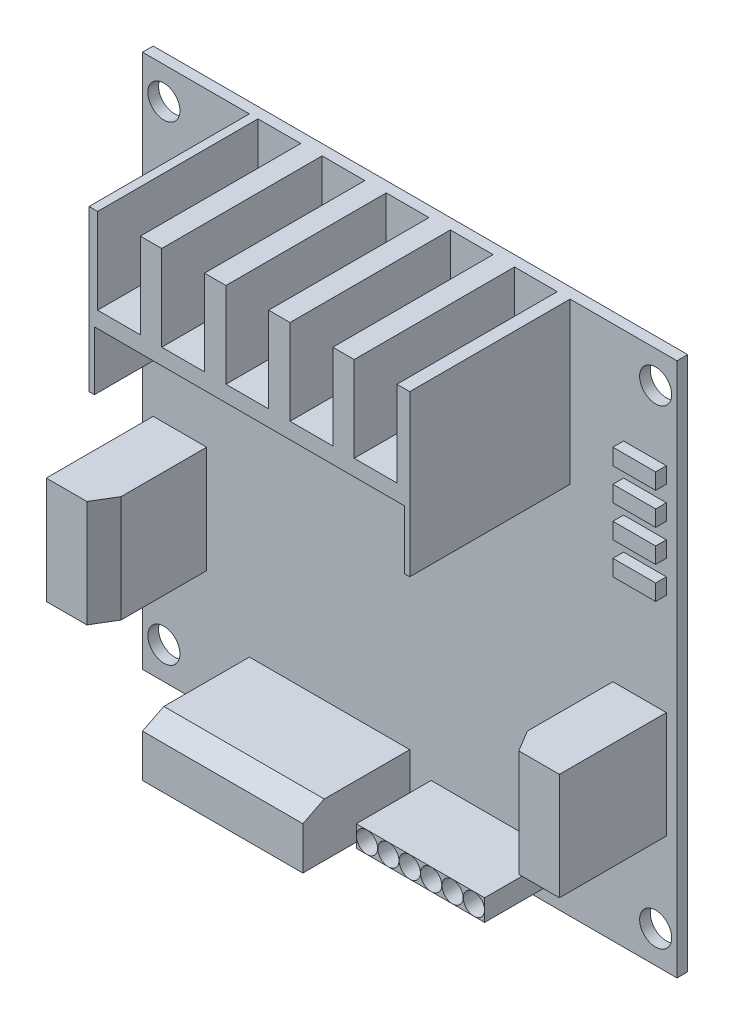
from build123d import *

# Parameters (mm, degrees)
SKETCH1_W               = 50
SKETCH1_H               = 50
BOSS_EXTRUDE1_DEPTH     = 1
SKETCH2_W               = 30
SKETCH2_H               = 15
BOSS_EXTRUDE2_DEPTH     = 15
SKETCH3_W               = 4
SKETCH3_H               = 8
CUT_EXTRUDE1_DEPTH      = 15
LPATTERN1_COUNT         = 5
LPATTERN1_PITCH         = 6
SKETCH4_W               = 28.997930891
SKETCH4_H               = 2
SKETCH4_H_2             = 2.5
SKETCH4_H_3             = 1
CUT_EXTRUDE2_DEPTH      = 2
CUT_EXTRUDE3_START      = -7
SKETCH4_3_W             = 28.997930891
SKETCH4_3_H             = 2
SKETCH4_3_H_2           = 2.5
CUT_EXTRUDE3_DEPTH      = 5
CUT_EXTRUDE4_START      = -15
SKETCH4_4_W             = 28.997930891
SKETCH4_4_H             = 2
CUT_EXTRUDE4_DEPTH      = 8
CUT_EXTRUDE5_DEPTH      = 1
SKETCH6_R               = 1.5
SKETCH6_W               = 2.5
SKETCH6_H               = 0.3
SKETCH6_W_2             = 0.3
SKETCH6_H_2             = 2.5
SKETCH6_H_3             = 1.1
SKETCH6_W_3             = 1.1
BOSS_EXTRUDE3_DEPTH     = 0.1
SKETCH6_3_R             = 1.5
BOSS_EXTRUDE4_DEPTH     = 1
SKETCH7_R               = 1.5
CUT_EXTRUDE6_DEPTH      = 73.284161474
SKETCH8_W               = 4
SKETCH8_H               = 1.5
BOSS_EXTRUDE5_DEPTH     = 1
LPATTERN2_COUNT         = 4
LPATTERN2_PITCH         = 3
MIRROR1_COPY_1_SKETCH_W = 4
MIRROR1_COPY_1_SKETCH_H = 1.5
MIRROR1_COPY_1_DEPTH    = 1
MIRROR1_COPY_2_SKETCH_W = 4
MIRROR1_COPY_2_SKETCH_H = 1.5
MIRROR1_COPY_2_DEPTH    = 1
MIRROR1_COPY_3_SKETCH_W = 4
MIRROR1_COPY_3_SKETCH_H = 1.5
MIRROR1_COPY_3_DEPTH    = 1
SKETCH9_W               = 5
SKETCH9_H               = 10
BOSS_EXTRUDE6_DEPTH     = 10
CUT_EXTRUDE7_DEPTH      = 10
SKETCH11_W              = 15
SKETCH11_H              = 5
BOSS_EXTRUDE7_DEPTH     = 10
CUT_EXTRUDE8_REACH      = 60.146
SKETCH13_W              = 2
SKETCH13_H              = 2
SKETCH13_R              = 0.995
BOSS_EXTRUDE9_DEPTH     = 7
LPATTERN3_COUNT         = 6
LPATTERN3_PITCH         = 2


with BuildPart() as part:
    # Sketch1 → Boss-Extrude1 (new body)
    with BuildSketch(Plane.XY):
        with Locations((25, 25)):
            Rectangle(SKETCH1_W, SKETCH1_H)
    extrude(amount=BOSS_EXTRUDE1_DEPTH)

    # Sketch2 → Boss-Extrude2 (add)
    with BuildSketch(Plane.XY.offset(1)):
        with Locations((25, 42.5)):
            Rectangle(SKETCH2_W, SKETCH2_H)
    extrude(amount=BOSS_EXTRUDE2_DEPTH)

    # Sketch3 → Cut-Extrude1 (cut)
    with BuildSketch(Plane.XY.offset(16)):
        with Locations((12.8, 46)):
            Rectangle(SKETCH3_W, SKETCH3_H)
    cut_extrude1 = extrude(amount=-CUT_EXTRUDE1_DEPTH, mode=Mode.SUBTRACT)

    # LPattern1: Cut-Extrude1 ×5
    with Locations(*[(i * LPATTERN1_PITCH, 0, 0) for i in range(1, LPATTERN1_COUNT)]):
        add(cut_extrude1, mode=Mode.SUBTRACT)

    # Sketch4 → Cut-Extrude2 (cut)
    with BuildSketch(Plane.XY.offset(16)):
        with Locations((25.001034555, 36)):
            Rectangle(SKETCH4_W, SKETCH4_H)
        with Locations((25.001034555, 38.25)):
            Rectangle(SKETCH4_W, SKETCH4_H_2)
        with Locations((25.001034555, 40)):
            Rectangle(SKETCH4_W, SKETCH4_H_3)
    extrude(amount=-CUT_EXTRUDE2_DEPTH, mode=Mode.SUBTRACT)

    # Sketch4<3> → Cut-Extrude3 (cut)
    with BuildSketch(Plane.XY.offset(16).offset(CUT_EXTRUDE3_START)):
        with Locations((25.001034555, 36)):
            Rectangle(SKETCH4_3_W, SKETCH4_3_H)
        with Locations((25.001034555, 38.25)):
            Rectangle(SKETCH4_3_W, SKETCH4_3_H_2)
    extrude(amount=CUT_EXTRUDE3_DEPTH, mode=Mode.SUBTRACT)

    # Sketch4<4> → Cut-Extrude4 (cut)
    with BuildSketch(Plane.XY.offset(16).offset(CUT_EXTRUDE4_START)):
        with Locations((25.001034555, 36)):
            Rectangle(SKETCH4_4_W, SKETCH4_4_H)
    extrude(amount=CUT_EXTRUDE4_DEPTH, mode=Mode.SUBTRACT)

    # Sketch5 → Cut-Extrude5 (cut)
    with BuildSketch(Plane.XZ.offset(-39.5)):
        Polygon((12.002069109, 14), (10.502069109, 14), (10.502069109, 12.5), align=None)
        Polygon((38, 14), (39.5, 14), (39.5, 12.5), align=None)
    extrude(amount=-CUT_EXTRUDE5_DEPTH, mode=Mode.SUBTRACT)

    # Sketch6 → Boss-Extrude3 (add)
    # profile 1 of 6: a face of its own
    with BuildSketch(Plane.XZ.offset(-39.5)):
        with Locations(Location((25.001034554, 11.5, 0), (0, 0, 270))):
            Circle(SKETCH6_R)
        with Locations((25.001034554, 11.5)):
            Rectangle(SKETCH6_W, SKETCH6_H, mode=Mode.SUBTRACT)
        with Locations((25.001034554, 11.5)):
            Rectangle(SKETCH6_W_2, SKETCH6_H_2, mode=Mode.SUBTRACT)
    # profile 2 of 6: a face of its own
    with BuildSketch(Plane.XZ.offset(-39.5)):
        with Locations((25.001034554, 10.8)):
            Rectangle(SKETCH6_W_2, SKETCH6_H_3)
    # profile 3 of 6: a face of its own
    with BuildSketch(Plane.XZ.offset(-39.5)):
        with Locations((25.701034554, 11.5)):
            Rectangle(SKETCH6_W_3, SKETCH6_H)
    # profile 4 of 6: a face of its own
    with BuildSketch(Plane.XZ.offset(-39.5)):
        with Locations((25.001034554, 12.2)):
            Rectangle(SKETCH6_W_2, SKETCH6_H_3)
    # profile 5 of 6: a face of its own
    with BuildSketch(Plane.XZ.offset(-39.5)):
        with Locations((25.001034554, 11.5)):
            Rectangle(SKETCH6_W_2, SKETCH6_H)
    # profile 6 of 6: a face of its own
    with BuildSketch(Plane.XZ.offset(-39.5)):
        with Locations((24.301034554, 11.5)):
            Rectangle(SKETCH6_W_3, SKETCH6_H)
    extrude(amount=BOSS_EXTRUDE3_DEPTH)

    # Sketch6<3> → Boss-Extrude4 (add)
    with BuildSketch(Plane.XZ.offset(-39.5)):
        with Locations(Location((25.001034554, 11.5, 0), (0, 0, 270))):
            Circle(SKETCH6_3_R)
        Polygon((25.151034554, 10.25), (24.851034554, 10.25), (24.851034554, 11.35), (23.751034554, 11.35), (23.751034554, 11.65), (24.851034554, 11.65), (24.851034554, 12.75), (25.151034554, 12.75), (25.151034554, 11.65), (26.251034554, 11.65), (26.251034554, 11.35), (25.151034554, 11.35), align=None, mode=Mode.SUBTRACT)
    extrude(amount=BOSS_EXTRUDE4_DEPTH)

    # Sketch7 → Cut-Extrude6 (cut, through all)
    with BuildSketch(Plane.XY.offset(1)):
        with Locations((48, 47)):
            Circle(SKETCH7_R)
        with Locations((48, 3)):
            Circle(SKETCH7_R)
        with Locations((2, 3)):
            Circle(SKETCH7_R)
        with Locations((2, 47)):
            Circle(SKETCH7_R)
    extrude(amount=-CUT_EXTRUDE6_DEPTH, mode=Mode.SUBTRACT)

    # Sketch8 → Boss-Extrude5 (add)
    with BuildSketch(Plane.XY.offset(1)):
        with Locations((47, 40.25)):
            Rectangle(SKETCH8_W, SKETCH8_H)
    boss_extrude5 = extrude(amount=BOSS_EXTRUDE5_DEPTH)

    # LPattern2: Boss-Extrude5 ×4
    with Locations(*[(0, -i * LPATTERN2_PITCH, 0) for i in range(1, LPATTERN2_COUNT)]):
        add(boss_extrude5)

    # Mirror1: Boss-Extrude5 across plane
    add(boss_extrude5.mirror(Plane(origin=(25, 0, 0), x_dir=(0, 0, 1), z_dir=(1, 0, 0))))

    # Mirror1 copy 1 sketch → Mirror1 copy 1 (add)
    with BuildSketch(Plane(origin=(50, -3, 1), x_dir=(-1, 0, 0), z_dir=(0, 0, 1))):
        with Locations((47, -40.25)):
            Rectangle(MIRROR1_COPY_1_SKETCH_W, MIRROR1_COPY_1_SKETCH_H)
    extrude(amount=MIRROR1_COPY_1_DEPTH)

    # Mirror1 copy 2 sketch → Mirror1 copy 2 (add)
    with BuildSketch(Plane(origin=(50, -6, 1), x_dir=(-1, 0, 0), z_dir=(0, 0, 1))):
        with Locations((47, -40.25)):
            Rectangle(MIRROR1_COPY_2_SKETCH_W, MIRROR1_COPY_2_SKETCH_H)
    extrude(amount=MIRROR1_COPY_2_DEPTH)

    # Mirror1 copy 3 sketch → Mirror1 copy 3 (add)
    with BuildSketch(Plane(origin=(50, -9, 1), x_dir=(-1, 0, 0), z_dir=(0, 0, 1))):
        with Locations((47, -40.25)):
            Rectangle(MIRROR1_COPY_3_SKETCH_W, MIRROR1_COPY_3_SKETCH_H)
    extrude(amount=MIRROR1_COPY_3_DEPTH)

    # Sketch9 → Boss-Extrude6 (add)
    with BuildSketch(Plane.XY.offset(1)):
        with Locations((46.5, 16)):
            Rectangle(SKETCH9_W, SKETCH9_H)
    boss_extrude6 = extrude(amount=BOSS_EXTRUDE6_DEPTH)

    # Sketch10 → Cut-Extrude7 (cut)
    with BuildSketch(Plane(origin=(0, 21, 0), x_dir=(1, 0, 0), z_dir=(0, 1, 0))):
        Polygon((45.2, -11), (44, -11), (44, -9), align=None)
    cut_extrude7 = extrude(amount=-CUT_EXTRUDE7_DEPTH, mode=Mode.SUBTRACT)

    # Mirror2: Boss-Extrude6, Cut-Extrude7 across plane
    add(boss_extrude6.mirror(Plane(origin=(25, 0, 0), x_dir=(0, 0, 1), z_dir=(1, 0, 0))))
    add(cut_extrude7.mirror(Plane(origin=(25, 0, 0), x_dir=(0, 0, 1), z_dir=(1, 0, 0))), mode=Mode.SUBTRACT)

    # Sketch11 → Boss-Extrude7 (add)
    with BuildSketch(Plane.XY.offset(1)):
        with Locations((17.5, 3.5)):
            Rectangle(SKETCH11_W, SKETCH11_H)
    extrude(amount=BOSS_EXTRUDE7_DEPTH)

    # Sketch12 → Cut-Extrude8 (cut, up to next)
    with BuildSketch(Plane(origin=(25, 0, 0), x_dir=(0, 0, -1), z_dir=(1, 0, 0)), mode=Mode.PRIVATE) as cut_extrude8_sk1:
        Polygon((-11, 5), (-11, 6), (-9, 6), align=None)
    cut_extrude8_tool1 = extrude(cut_extrude8_sk1.sketch, amount=-CUT_EXTRUDE8_REACH, mode=Mode.PRIVATE) & part.part
    add(cut_extrude8_tool1.solids().sort_by_distance((25, 5.666667, 10.333333))[0], mode=Mode.SUBTRACT)

    # Sketch13 → Boss-Extrude9 (add)
    with BuildSketch(Plane.XY.offset(1)):
        with Locations((28, 3.5)):
            Rectangle(SKETCH13_W, SKETCH13_H)
        with Locations((28, 3.5)):
            Circle(SKETCH13_R, mode=Mode.SUBTRACT)
    boss_extrude9 = extrude(amount=BOSS_EXTRUDE9_DEPTH)

    # LPattern3: Boss-Extrude9 ×6
    with Locations(*[(i * LPATTERN3_PITCH, 0, 0) for i in range(1, LPATTERN3_COUNT)]):
        add(boss_extrude9)


solid = part.part
